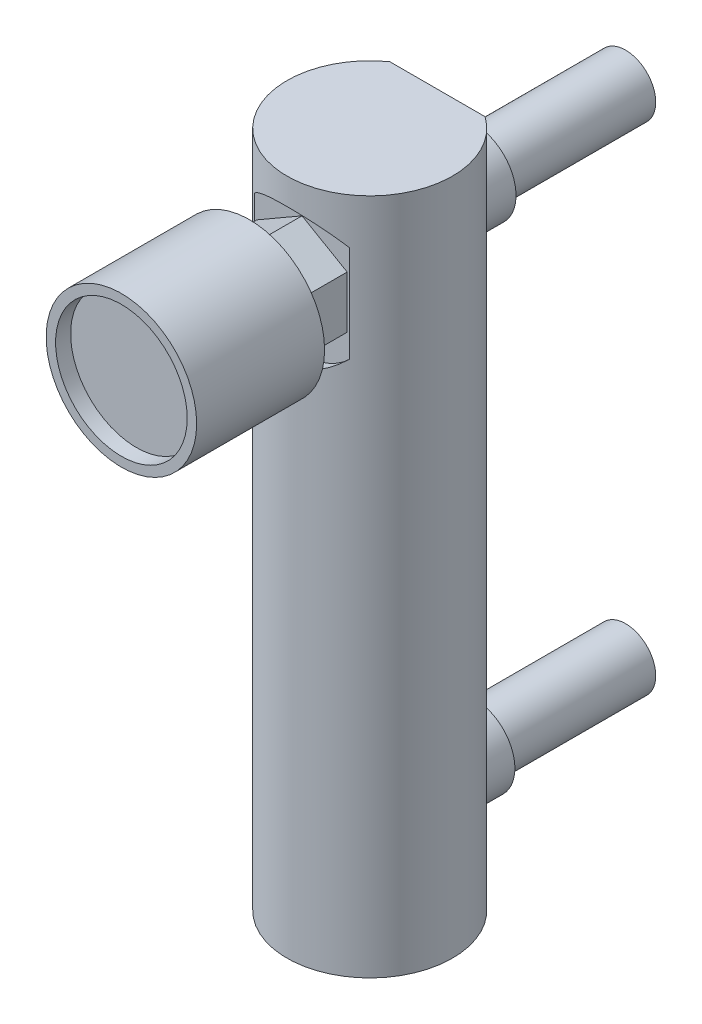
from build123d import *

# Parameters (mm, degrees)
SALIENTE_EXTRUIR1_DEPTH = 90
CROQUIS3_R              = 9
CORTAR_EXTRUIR1_DEPTH   = 93.439169187
SALIENTE_EXTRUIR2_DEPTH = 5
CROQUIS5_R              = 1.700741298
SALIENTE_EXTRUIR3_DEPTH = 19
CROQUIS6_R              = 10
SALIENTE_EXTRUIR4_DEPTH = 17
CROQUIS7_R              = 8.745057349
CORTAR_EXTRUIR2_DEPTH   = 2
CROQUIS8_R              = 4.582163127
CORTAR_EXTRUIR3_DEPTH   = 72
CROQUIS9_R              = 4
SALIENTE_EXTRUIR5_DEPTH = 25
CROQUIS10_R             = 5.43607756
CROQUIS10_R_2           = 5.282430738
SALIENTE_EXTRUIR6_DEPTH = 5


with BuildPart() as part:
    # Croquis1 → Saliente-Extruir1 (new body)
    with BuildSketch(Plane(origin=(0, 0, 0), x_dir=(1, 0, 0), z_dir=(0, 1, 0))):
        with BuildLine():
            Line((6.32455532, 9), (-6.32455532, 9))
            ThreePointArc((-6.32455532, 9), (-5.070990607, -9.761406367), (11, 0))
            ThreePointArc((11, 0), (9.761406367, 5.070990607), (6.32455532, 9))
        make_face()
    extrude(amount=SALIENTE_EXTRUIR1_DEPTH)

    # Croquis3 → Cortar-Extruir1 (cut, through all)
    with BuildSketch(Plane(origin=(0, 0, 9), x_dir=(-1, 0, 0), z_dir=(0, 0, -1))):
        with Locations((0, 77.5)):
            Circle(CROQUIS3_R)
    extrude(amount=-CORTAR_EXTRUIR1_DEPTH, mode=Mode.SUBTRACT)

    # Croquis4 → Saliente-Extruir2 (add)
    with BuildSketch(Plane.XY.offset(9)):
        Polygon((0, 70.57179677), (6, 74.035898385), (6, 80.964101615), (0, 84.42820323), (-6, 80.964101615), (-6, 74.035898385), align=None)
    extrude(amount=SALIENTE_EXTRUIR2_DEPTH)

    # Croquis5 → Saliente-Extruir3 (add)
    with BuildSketch(Plane.XY.offset(14)):
        with Locations((0, 77.5)):
            Circle(CROQUIS5_R)
    extrude(amount=SALIENTE_EXTRUIR3_DEPTH)

    # Croquis6 → Saliente-Extruir4 (add)
    with BuildSketch(Plane.XY.offset(33)):
        with Locations((0, 77.5)):
            Circle(CROQUIS6_R)
    extrude(amount=-SALIENTE_EXTRUIR4_DEPTH)

    # Croquis7 → Cortar-Extruir2 (cut)
    with BuildSketch(Plane.XY.offset(33)):
        with Locations((0, 77.5)):
            Circle(CROQUIS7_R)
    extrude(amount=-CORTAR_EXTRUIR2_DEPTH, mode=Mode.SUBTRACT)

    # Croquis8 → Cortar-Extruir3 (cut)
    with BuildSketch(Plane(origin=(0, 11, 0), x_dir=(-1, 0, 0), z_dir=(0, -1, 0))):
        with Locations(Location((0, 0, 0), (0, 0, 90))):
            Circle(CROQUIS8_R)
    extrude(amount=-CORTAR_EXTRUIR3_DEPTH, mode=Mode.SUBTRACT)

    # Croquis9 → Saliente-Extruir5 (add)
    with BuildSketch(Plane(origin=(0, 0, -9), x_dir=(-1, 0, 0), z_dir=(0, 0, -1))):
        with Locations((0, 78)):
            Circle(CROQUIS9_R)
        with Locations(Location((0, 12, 0), (0, 0, 180))):
            Circle(CROQUIS9_R)
    extrude(amount=SALIENTE_EXTRUIR5_DEPTH)

    # Croquis10 → Saliente-Extruir6 (add)
    with BuildSketch(Plane(origin=(0, 0, -9), x_dir=(-1, 0, 0), z_dir=(0, 0, -1))):
        with Locations((0, 78)):
            Circle(CROQUIS10_R)
        with Locations((0, 12)):
            Circle(CROQUIS10_R_2)
    extrude(amount=SALIENTE_EXTRUIR6_DEPTH)


solid = part.part
